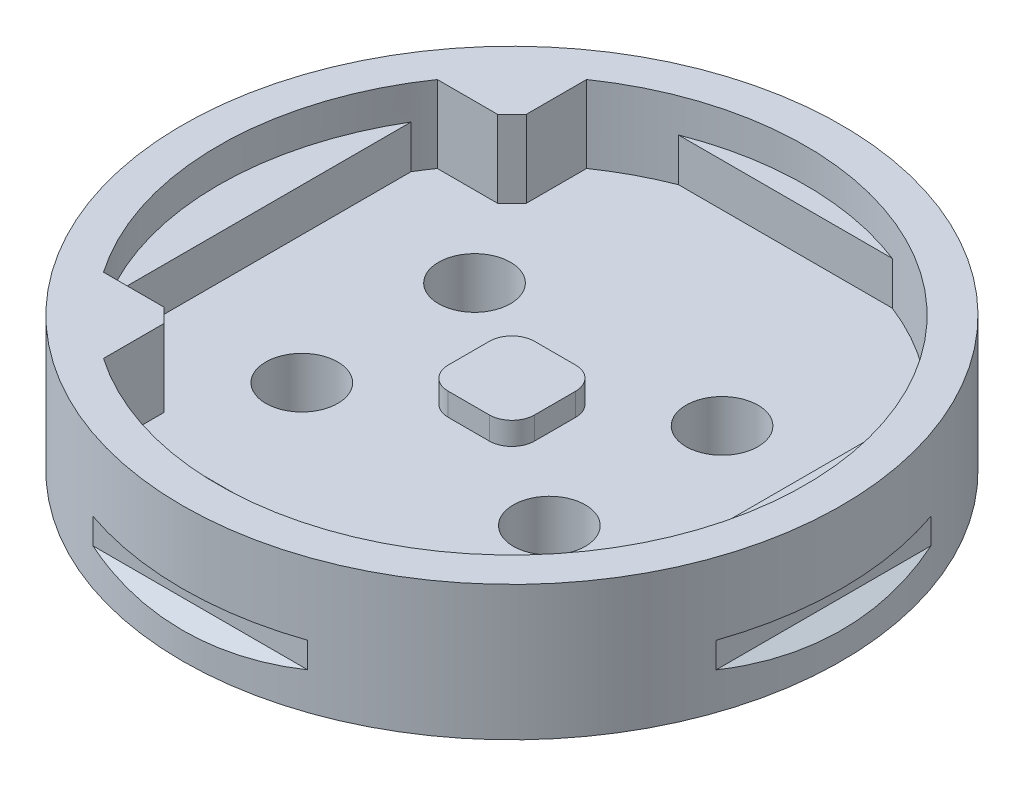
from build123d import *
from build123d.topology import SkipClean

# Parameters (mm, degrees)
SKETCH1_R           = 14.5415
BOSS_EXTRUDE2_DEPTH = 2.54
BOSS_EXTRUDE4_START = 2.54
SKETCH1_8_W         = 3.81
SKETCH1_8_H         = 3.81
BOSS_EXTRUDE4_DEPTH = 1
BOSS_EXTRUDE3_START = 2.54
SKETCH1_6_R         = 14.5415
BOSS_EXTRUDE3_DEPTH = 1.9
SKETCH1_9_R         = 1.5875
CUT_EXTRUDE2_DEPTH  = 3.175
SKETCH2_R           = 14.5415
SKETCH2_R_2         = 12.954
BOSS_EXTRUDE5_DEPTH = 1.5
BOSS_EXTRUDE6_DEPTH = 3.4
FILLET1_R           = 1
CHAMFER1_SIZE       = 0.635
CUT_EXTRUDE3_DEPTH  = 22.405467631
CIRPATTERN1_COUNT   = 4


with BuildPart() as part:
    # Sketch1 → Boss-Extrude2 (new body)
    with BuildSketch(Plane(origin=(0, 0, 0), x_dir=(1, 0, 0), z_dir=(0, 1, 0))):
        with Locations(Location((0, 0, 0), (0, 0, 270))):
            Circle(SKETCH1_R)
    extrude(amount=BOSS_EXTRUDE2_DEPTH)

    # Sketch1<8> → Boss-Extrude4 (add)
    with BuildSketch(Plane(origin=(0, 0, 0), x_dir=(1, 0, 0), z_dir=(0, 1, 0)).offset(BOSS_EXTRUDE4_START)):
        Rectangle(SKETCH1_8_W, SKETCH1_8_H)
    extrude(amount=BOSS_EXTRUDE4_DEPTH)

    # Sketch1<6> → Boss-Extrude3 (add)
    with BuildSketch(Plane(origin=(0, 0, 0), x_dir=(1, 0, 0), z_dir=(0, 1, 0)).offset(BOSS_EXTRUDE3_START)):
        with Locations(Location((0, 0, 0), (0, 0, 90))):
            Circle(SKETCH1_6_R)
        with BuildLine():
            ThreePointArc((6.096, -11.43), (8.929053506, -9.384994379), (11.1125, -6.657211109))
            Line((11.1125, -6.657211109), (11.1125, 6.657211109))
            ThreePointArc((11.1125, 6.657211109), (8.363458286, 9.8923547), (4.716130935, 12.065))
            Line((4.716130935, 12.065), (-4.716130935, 12.065))
            ThreePointArc((-4.716130935, 12.065), (-8.363458286, 9.8923547), (-11.1125, 6.657211109))
            Line((-11.1125, 6.657211109), (-11.1125, -6.657211109))
            ThreePointArc((-11.1125, -6.657211109), (-8.929053506, -9.384994379), (-6.096, -11.43))
            Line((-6.096, -11.43), (6.096, -11.43))
        make_face(mode=Mode.SUBTRACT)
    extrude(amount=BOSS_EXTRUDE3_DEPTH)

    # Sketch1<9> → Cut-Extrude2 (cut)
    with BuildSketch(Plane(origin=(0, 0, 0), x_dir=(1, 0, 0), z_dir=(0, 1, 0))):
        with Locations(Location((0, 0, 0), (0, 0, 270))):
            Circle(SKETCH1_9_R)
        with Locations(Location((-5.461, 3.81, 0), (0, 0, 270))):
            Circle(SKETCH1_9_R)
        with Locations(Location((5.461, 3.81, 0), (0, 0, 270))):
            Circle(SKETCH1_9_R)
        with Locations(Location((5.461, -3.81, 0), (0, 0, 270))):
            Circle(SKETCH1_9_R)
        with Locations(Location((-5.461, -3.81, 0), (0, 0, 270))):
            Circle(SKETCH1_9_R)
    extrude(amount=CUT_EXTRUDE2_DEPTH, mode=Mode.SUBTRACT)

    # Sketch2 → Boss-Extrude5 (add)
    with BuildSketch(Plane(origin=(0, 4.44, 0), x_dir=(1, 0, 0), z_dir=(0, 1, 0))):
        with Locations(Location((0, 0, 0), (0, 0, 270))):
            Circle(SKETCH2_R)
        with Locations(Location((0, 0, 0), (0, 0, 68.649791106))):
            Circle(SKETCH2_R_2, mode=Mode.SUBTRACT)
    extrude(amount=BOSS_EXTRUDE5_DEPTH)

    # Sketch3 → Boss-Extrude6 (add)
    with BuildSketch(Plane(origin=(0, 2.54, 0), x_dir=(1, 0, 0), z_dir=(0, 1, 0))):
        with BuildLine():
            Line((-10.657411412, 7.363810019), (-7.363810019, 7.363810019))
            Line((-7.363810019, 7.363810019), (-7.363810019, 10.657411412))
            ThreePointArc((-7.363810019, 10.657411412), (-9.159861243, 9.159861243), (-10.657411412, 7.363810019))
        make_face()
        with BuildLine():
            Line((-10.657411412, -7.363810019), (-7.363810019, -7.363810019))
            Line((-7.363810019, -7.363810019), (-7.363810019, -10.657411412))
            ThreePointArc((-7.363810019, -10.657411412), (-9.159861243, -9.159861243), (-10.657411412, -7.363810019))
        make_face()
    extrude(amount=BOSS_EXTRUDE6_DEPTH)

    # Fillet1
    fillet1_edges = [part.edges().sort_by_distance(p)[0] for p in [
        (1.905, 3.04, -1.905),
        (-1.905, 3.04, -1.905),
        (-1.905, 3.04, 1.905),
        (1.905, 3.04, 1.905),
    ]]
    fillet(fillet1_edges, radius=FILLET1_R)

    # Chamfer1
    chamfer1_edges = [part.edges().sort_by_distance(p)[0] for p in [
        (-7.363810019, 4.24, 7.363810019),
        (-7.363810019, 4.24, -7.363810019),
    ]]
    chamfer(chamfer1_edges, length=CHAMFER1_SIZE)

    # Sketch4 → Cut-Extrude3 (cut, symmetric)
    with SkipClean():  # the faces are left unmerged after this step: merging them gives an invalid solid
        with BuildSketch(Plane.XY):
            Polygon((-14.5415, 2.765), (-13.74775, 2.765), (-13.74775, 1.635771776), (-14.5415, 1.1775), align=None)
        cut_extrude3 = extrude(amount=CUT_EXTRUDE3_DEPTH, both=True, mode=Mode.SUBTRACT)

    # CirPattern1: Cut-Extrude3 ×4 about axis
    with SkipClean():  # the faces are left unmerged after this step: merging them gives an invalid solid
        cirpattern1_axis = Axis((0, 0, 0), (0, 1, 0))
        for i in range(1, CIRPATTERN1_COUNT):
            add(cut_extrude3.rotate(cirpattern1_axis, i * 360 / CIRPATTERN1_COUNT), mode=Mode.SUBTRACT)


solid = part.part
